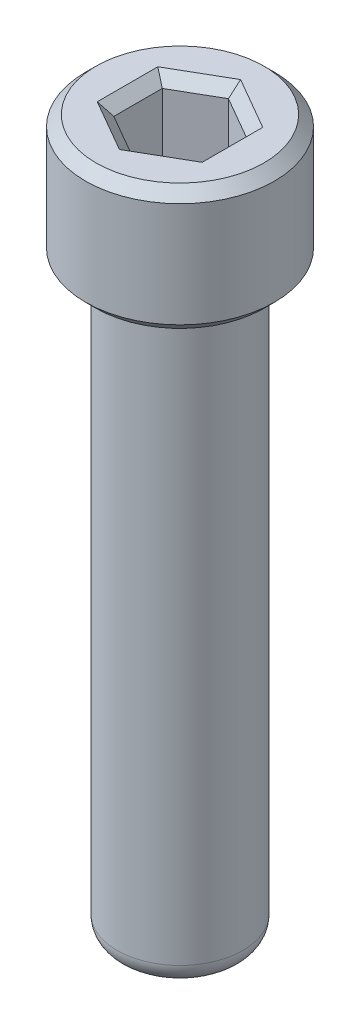
from build123d import *

# Parameters (mm, degrees)
SKETCH1_R           = 1.5
BOSS_EXTRUDE1_DEPTH = 14
SKETCH2_R           = 2.25
BOSS_EXTRUDE2_DEPTH = 3
CUT_EXTRUDE1_DEPTH  = 2
CHAMFER1_SIZE       = 0.25
FILLET1_R           = 0.5


with BuildPart() as part:
    # Sketch1 → Boss-Extrude1 (new body)
    with BuildSketch(Plane(origin=(0, 0, 0), x_dir=(1, 0, 0), z_dir=(0, 1, 0))):
        with Locations(Location((0, 0, 0), (0, 0, 270))):
            Circle(SKETCH1_R)
    extrude(amount=BOSS_EXTRUDE1_DEPTH)

    # Sketch2 → Boss-Extrude2 (add)
    with BuildSketch(Plane(origin=(0, 14, 0), x_dir=(1, 0, 0), z_dir=(0, 1, 0))):
        with Locations(Location((0, 0, 0), (0, 0, 270))):
            Circle(SKETCH2_R)
    extrude(amount=BOSS_EXTRUDE2_DEPTH)

    # Sketch3 → Cut-Extrude1 (cut)
    with BuildSketch(Plane(origin=(0, 17, 0), x_dir=(1, 0, 0), z_dir=(0, 1, 0))):
        Polygon((0, 1.154700538), (-1, 0.577350269), (-1, -0.577350269), (0, -1.154700538), (1, -0.577350269), (1, 0.577350269), align=None)
    extrude(amount=-CUT_EXTRUDE1_DEPTH, mode=Mode.SUBTRACT)

    # Chamfer1
    chamfer1_edges = [part.edges().sort_by_distance(p)[0] for p in [
        (0.5, 17, -0.866025404),
        (-0.5, 17, -0.866025404),
        (-1, 17, 0),
        (-0.5, 17, 0.866025404),
        (0.5, 17, 0.866025404),
        (1, 17, 0),
        (0, 14, -2.25),
        (0, 17, -2.25),
    ]]
    chamfer(chamfer1_edges, length=CHAMFER1_SIZE)

    # Fillet1
    fillet1_edges = [part.edges().sort_by_distance(p)[0] for p in [
        (0, 0, -1.5),
    ]]
    fillet(fillet1_edges, radius=FILLET1_R)


solid = part.part
